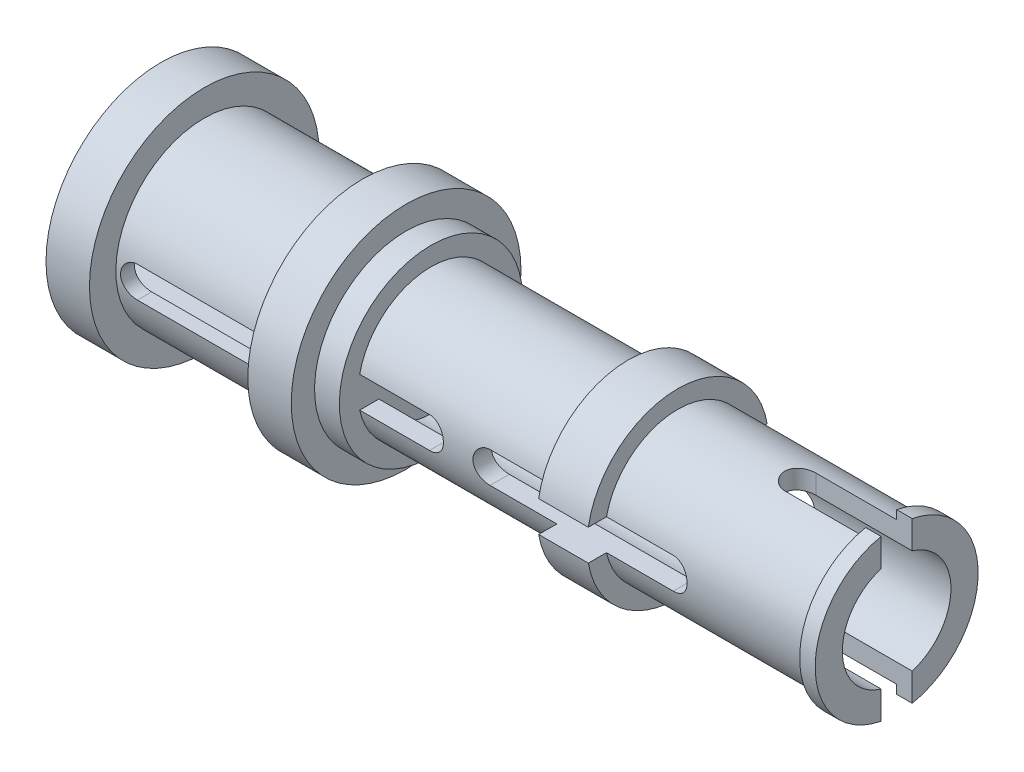
from build123d import *

# Parameters (mm, degrees)
SKETCH1_R              = 2.925
SKETCH1_R_2            = 1.75
MIDDLE_RING_DEPTH      = 0.8
SKETCH2_R              = 2.35
SKETCH2_R_2            = 1.75
OUTER_BODY_DEPTH       = 7.35
SKETCH3_R              = 2.625
SKETCH3_R_2            = 1.75
OUTER_RIM_DEPTH        = 0.5
MIDDLE_SLOT_DEPTH      = 9.873204044
MIDDLE_SLOT_DEPTH_BACK = 9.873204044
SIDE_SLOTS_DEPTH       = 9.859105574
SIDE_SLOTS_DEPTH_BACK  = 9.859105574
SKETCH7_W              = 1.8
SKETCH7_H              = 1.8
AXLE_CUT_DEPTH         = 7.9
BUSH_SLOT_DEPTH        = 17.691389996
BUSH_SLOT_DEPTH_BACK   = 17.691389996


with BuildPart() as part:
    # Sketch1 → Middle Ring (new, symmetric)
    with BuildSketch(Plane(origin=(0, 0, 0), x_dir=(0, 0, -1), z_dir=(1, 0, 0))):
        Circle(SKETCH1_R)
        Circle(SKETCH1_R_2, mode=Mode.SUBTRACT)
    extrude(amount=MIDDLE_RING_DEPTH, both=True)

    # Sketch2 → Outer Body (add, symmetric)
    with BuildSketch(Plane(origin=(0, 0, 0), x_dir=(0, 0, -1), z_dir=(1, 0, 0))):
        Circle(SKETCH2_R)
        Circle(SKETCH2_R_2, mode=Mode.SUBTRACT)
    extrude(amount=OUTER_BODY_DEPTH, both=True)

    # Sketch3 → Outer Rim (add)
    with BuildSketch(Plane(origin=(7.35, 0, 0), x_dir=(0, 0, -1), z_dir=(1, 0, 0))):
        Circle(SKETCH3_R)
        Circle(SKETCH3_R_2, mode=Mode.SUBTRACT)
    outer_rim = extrude(amount=OUTER_RIM_DEPTH)

    # Mirror1: Outer Rim across plane
    add(outer_rim.mirror(Plane(origin=(0, 0, 0), x_dir=(0, 0, 1), z_dir=(1, 0, 0))))

    # Sketch4 → Middle Slot (cut, two sides: drawn at the far end of the back side and taken through both)
    with BuildSketch(Plane.XY.offset(-MIDDLE_SLOT_DEPTH_BACK)):
        with BuildLine():
            Line((2.95, -0.5), (-2.95, -0.5))
            ThreePointArc((-2.95, -0.5), (-3.45, 0), (-2.95, 0.5))
            Line((-2.95, 0.5), (2.95, 0.5))
            ThreePointArc((2.95, 0.5), (3.45, 0), (2.95, -0.5))
        make_face()
        with BuildLine():
            Line((-10.8, 0.5), (-4.9, 0.5))
            ThreePointArc((-4.9, 0.5), (-4.4, 0), (-4.9, -0.5))
            Line((-4.9, -0.5), (-10.8, -0.5))
            ThreePointArc((-10.8, -0.5), (-11.3, 0), (-10.8, 0.5))
        make_face()
    extrude(amount=MIDDLE_SLOT_DEPTH + MIDDLE_SLOT_DEPTH_BACK, mode=Mode.SUBTRACT)

    # Sketch5 → Side Slots (cut, two sides: drawn at the far end of the back side and taken through both)
    with BuildSketch(Plane(origin=(0, 0, 0), x_dir=(1, 0, 0), z_dir=(0, 1, 0)).offset(-SIDE_SLOTS_DEPTH_BACK)):
        with BuildLine():
            Line((10.95, -0.5), (4.75, -0.5))
            ThreePointArc((4.75, -0.5), (4.25, 0), (4.75, 0.5))
            Line((4.75, 0.5), (10.95, 0.5))
            ThreePointArc((10.95, 0.5), (11.45, 0), (10.95, -0.5))
        make_face()
    extrude(amount=SIDE_SLOTS_DEPTH + SIDE_SLOTS_DEPTH_BACK, mode=Mode.SUBTRACT)

    # Sketch6 → Large Bush (revolve)
    with BuildSketch(Plane.XY, mode=Mode.PRIVATE) as large_bush_sk:
        Polygon((-15.85, 0), (-15.85, 3.7), (-14.45, 3.7), (-14.45, 2.85), (-9.35, 2.85), (-9.35, 3.7), (-7.95, 3.7), (-7.95, 2.95), (-7.15, 2.95), (-7.15, 0), align=None)
    revolve(large_bush_sk.sketch.rotate(Axis((0, 0, 0), (-1, 0, 0)), 257.715539925), axis=Axis((0, 0, 0), (-1, 0, 0)))

    # Sketch7 → Axle Cut (cut)
    with BuildSketch(Plane.ZY.offset(15.85)):
        with BuildLine():
            Line((-0.9, 0.9), (0.9, 0.9))
            Line((0.9, 0.9), (0.9, 2.224859546))
            ThreePointArc((0.9, 2.224859546), (0.45844143, 2.355808026), (0, 2.4))
            ThreePointArc((0, 2.4), (-0.45844143, 2.355808026), (-0.9, 2.224859546))
            Line((-0.9, 2.224859546), (-0.9, 0.9))
        make_face()
        Rectangle(SKETCH7_W, SKETCH7_H)
        with BuildLine():
            Line((-2.224859546, -0.9), (-0.9, -0.9))
            Line((-0.9, -0.9), (-0.9, 0.9))
            Line((-0.9, 0.9), (-2.224859546, 0.9))
            ThreePointArc((-2.224859546, 0.9), (-2.355808026, 0.458441427), (-2.4, -5e-09))
            ThreePointArc((-2.4, -5e-09), (-2.355808026, -0.458441432), (-2.224859546, -0.9))
        make_face()
        with BuildLine():
            Line((0.9, 0.9), (0.9, -0.9))
            Line((0.9, -0.9), (2.224859546, -0.9))
            ThreePointArc((2.224859546, -0.9), (2.355808026, -0.45844143), (2.4, 0))
            ThreePointArc((2.4, 0), (2.355808026, 0.45844143), (2.224859546, 0.9))
            Line((2.224859546, 0.9), (0.9, 0.9))
        make_face()
        with BuildLine():
            ThreePointArc((-0.9, -2.224859546), (-0.45844143, -2.355808026), (0, -2.4))
            ThreePointArc((0, -2.4), (0.45844143, -2.355808026), (0.9, -2.224859546))
            Line((0.9, -2.224859546), (0.9, -0.9))
            Line((0.9, -0.9), (-0.9, -0.9))
            Line((-0.9, -0.9), (-0.9, -2.224859546))
        make_face()
    extrude(amount=-AXLE_CUT_DEPTH, mode=Mode.SUBTRACT)

    # Sketch9 → Bush Slot (cut, two sides: drawn at the far end of the back side and taken through both)
    with BuildSketch(Plane.XY.offset(-BUSH_SLOT_DEPTH_BACK)):
        with BuildLine():
            Line((-13.8, 0.5), (-10, 0.5))
            ThreePointArc((-10, 0.5), (-9.5, 0), (-10, -0.5))
            Line((-10, -0.5), (-13.8, -0.5))
            ThreePointArc((-13.8, -0.5), (-14.3, 0), (-13.8, 0.5))
        make_face()
    extrude(amount=BUSH_SLOT_DEPTH + BUSH_SLOT_DEPTH_BACK, mode=Mode.SUBTRACT)


solid = part.part
